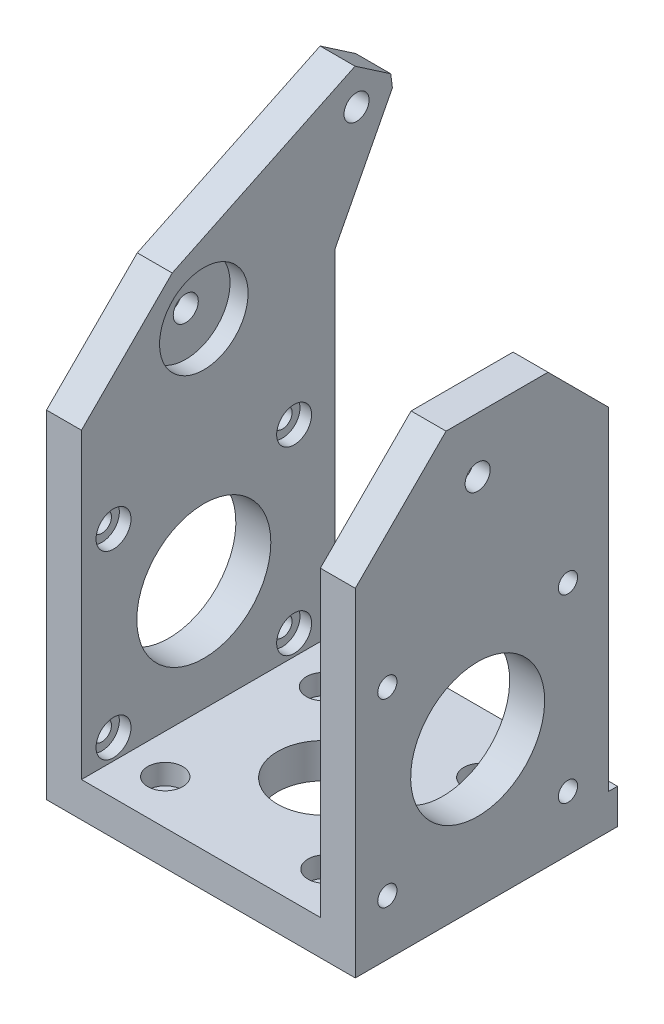
from build123d import *

# Parameters (mm, degrees)
EXTRUDE_1_DEPTH     = 64
SKETCH_2_R          = 7.85
SKETCH_2_R_2        = 1.65
CUT_EXTRUDE_1_DEPTH = 20
SKETCH_3_R          = 3
CUT_EXTRUDE_2_DEPTH = 3.5
CUT_EXTRUDE_3_DEPTH = 111.938045773
SKETCH_5_R          = 11.5
SKETCH_5_R_2        = 1.65
SKETCH_5_R_3        = 2.15
CUT_EXTRUDE_4_DEPTH = 104.981969591
SKETCH_6_R          = 7.6
CUT_EXTRUDE_5_DEPTH = 3.1
CUT_EXTRUDE_START   = -3.1
SKETCH_7_R          = 7.6
CUT_EXTRUDE_6_DEPTH = 3.1
SKETCH_10_R         = 2.15
EXTRUDE_3_DEPTH     = 6
SKETCH_11_R         = 3
CUT_EXTRUDE_7_DEPTH = 2
CUT_EXTRUDE_START_2 = -2
SKETCH_12_R         = 3
CUT_EXTRUDE_8_DEPTH = 2


with BuildPart() as part:
    # 草图1 → 凸台-拉伸1 (new body)
    with BuildSketch(Plane.XY):
        Polygon((-20.5, 73.5), (-26.5, 73.5), (-26.5, 0), (26.5, 0), (26.5, 73.5), (20.5, 73.5), (20.5, 6), (-20.5, 6), align=None)
    extrude(amount=EXTRUDE_1_DEPTH)

    # 草图2 → 切除-拉伸1 (cut)
    with BuildSketch(Plane(origin=(0, 6, 0), x_dir=(1, 0, 0), z_dir=(0, 1, 0))):
        with Locations(Location((0, -30, 0), (0, 0, 180))):
            Circle(SKETCH_2_R)
        with Locations(Location((-13.5, -16.374856692, 0), (0, 0, 180))):
            Circle(SKETCH_2_R_2)
        with Locations(Location((-13.749126603, -43.373707333, 0), (0, 0, 180))):
            Circle(SKETCH_2_R_2)
        with Locations(Location((13.749126603, -43.373707333, 0), (0, 0, 180))):
            Circle(SKETCH_2_R_2)
        with Locations(Location((13.5, -16.374856692, 0), (0, 0, 180))):
            Circle(SKETCH_2_R_2)
    extrude(amount=-CUT_EXTRUDE_1_DEPTH, mode=Mode.SUBTRACT)

    # 草图3 → 切除-拉伸2 (cut)
    with BuildSketch(Plane(origin=(0, 6, 0), x_dir=(1, 0, 0), z_dir=(0, 1, 0))):
        with Locations(Location((-13.5, -16.374856692, 0), (0, 0, 180))):
            Circle(SKETCH_3_R)
        with Locations(Location((13.5, -16.374856692, 0), (0, 0, 180))):
            Circle(SKETCH_3_R)
        with Locations(Location((13.749126603, -43.373707333, 0), (0, 0, 180))):
            Circle(SKETCH_3_R)
        with Locations(Location((-13.749126603, -43.373707333, 0), (0, 0, 180))):
            Circle(SKETCH_3_R)
    extrude(amount=-CUT_EXTRUDE_2_DEPTH, mode=Mode.SUBTRACT)

    # 草图4 → 切除-拉伸3 (cut, through all)
    with BuildSketch(Plane(origin=(26.5, 0, 0), x_dir=(0, 0, -1), z_dir=(1, 0, 0))):
        Polygon((-64, 0), (-51, 0), (-51, 57.922560455), (-35.422560455, 73.5), (-64, 73.5), align=None)
        Polygon((-6, 6), (-6, 0), (0, 0), (0, 73.5), (-17.922560455, 73.5), (-7.5, 63.077439545), (-7.5, 6), align=None)
    extrude(amount=-CUT_EXTRUDE_3_DEPTH, mode=Mode.SUBTRACT)

    # 草图5 → 切除-拉伸4 (cut, through all)
    with BuildSketch(Plane(origin=(26.5, 0, 0), x_dir=(0, 0, -1), z_dir=(1, 0, 0))):
        with Locations(Location((-30, 25, 0), (0, 0, 90))):
            Circle(SKETCH_5_R)
        with Locations(Location((-45.5, 9.5, 0), (0, 0, 90))):
            Circle(SKETCH_5_R_2)
        with Locations(Location((-14.5, 9.5, 0), (0, 0, 90))):
            Circle(SKETCH_5_R_2)
        with Locations(Location((-14.5, 40.5, 0), (0, 0, 90))):
            Circle(SKETCH_5_R_2)
        with Locations(Location((-45.5, 40.5, 0), (0, 0, 90))):
            Circle(SKETCH_5_R_2)
        with Locations(Location((-30, 64, 0), (0, 0, 90))):
            Circle(SKETCH_5_R_3)
    extrude(amount=-CUT_EXTRUDE_4_DEPTH, mode=Mode.SUBTRACT)

    # 草图6 → 切除-拉伸5 (cut)
    with BuildSketch(Plane(origin=(-20.5, 0, 0), x_dir=(0, 0, -1), z_dir=(1, 0, 0))):
        with Locations(Location((-30, 64, 0), (0, 0, 90))):
            Circle(SKETCH_6_R)
    extrude(amount=-CUT_EXTRUDE_5_DEPTH, mode=Mode.SUBTRACT)

    # 草图7 → 切除-拉伸6 (cut)
    with BuildSketch(Plane.ZY.offset(-20.5).offset(CUT_EXTRUDE_START)):
        with Locations(Location((30, 64, 0), (0, 0, 90))):
            Circle(SKETCH_7_R)
    extrude(amount=CUT_EXTRUDE_6_DEPTH, mode=Mode.SUBTRACT)

    # 草图10 → 凸台-拉伸3 (add)
    with BuildSketch(Plane.ZY.offset(26.5)):
        Polygon((35.422560455, 73.5), (4.042079148, 88.554140582), (-2.082502765, 84.366551206), (-2.369521453, 82.13565887), (7.5, 63.077439545), (17.922560455, 73.5), align=None)
        with Locations(Location((3.787134583, 82.354445963, 0), (0, 0, 270))):
            Circle(SKETCH_10_R, mode=Mode.SUBTRACT)
    extrude(amount=-EXTRUDE_3_DEPTH)

    # 草图11 → 切除-拉伸7 (cut)
    with BuildSketch(Plane(origin=(-20.5, 0, 0), x_dir=(0, 0, -1), z_dir=(1, 0, 0))):
        with Locations(Location((-45.5, 40.5, 0), (0, 0, 90))):
            Circle(SKETCH_11_R)
        with Locations(Location((-14.5, 40.5, 0), (0, 0, 90))):
            Circle(SKETCH_11_R)
        with Locations(Location((-45.5, 9.5, 0), (0, 0, 90))):
            Circle(SKETCH_11_R)
        with Locations(Location((-14.5, 9.5, 0), (0, 0, 90))):
            Circle(SKETCH_11_R)
    extrude(amount=-CUT_EXTRUDE_7_DEPTH, mode=Mode.SUBTRACT)

    # 草图12 → 切除-拉伸8 (cut)
    with BuildSketch(Plane.ZY.offset(-20.5).offset(CUT_EXTRUDE_START_2)):
        with Locations(Location((14.5, 40.5, 0), (0, 0, 90))):
            Circle(SKETCH_12_R)
        with Locations(Location((45.5, 40.5, 0), (0, 0, 90))):
            Circle(SKETCH_12_R)
        with Locations(Location((45.5, 9.5, 0), (0, 0, 90))):
            Circle(SKETCH_12_R)
        with Locations(Location((14.5, 9.5, 0), (0, 0, 90))):
            Circle(SKETCH_12_R)
    extrude(amount=CUT_EXTRUDE_8_DEPTH, mode=Mode.SUBTRACT)


solid = part.part
